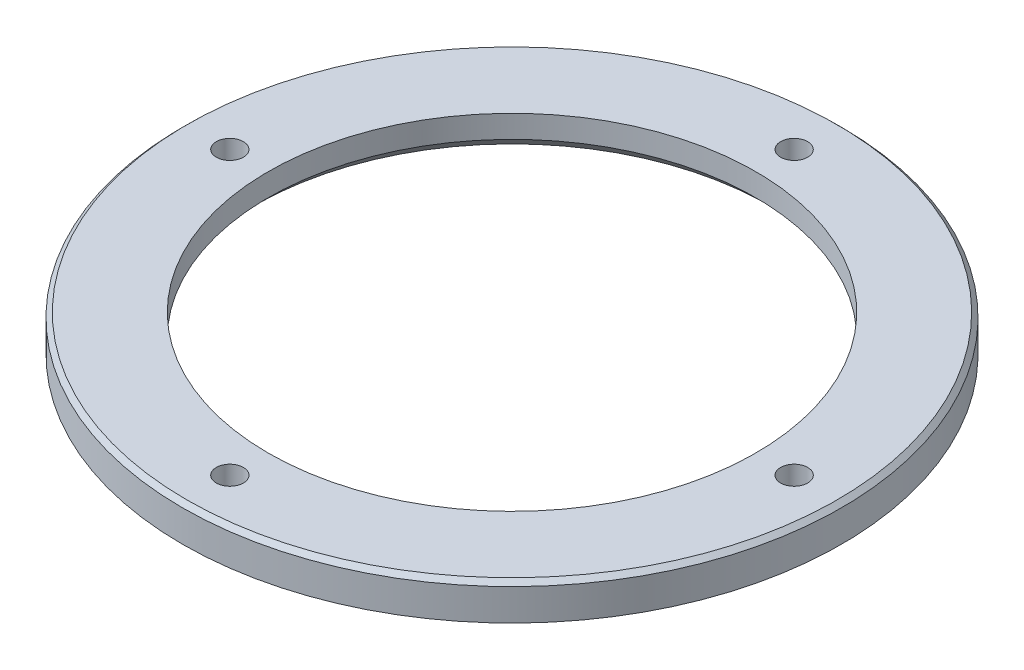
from build123d import *

# Parameters (mm, degrees)
SKETCH_1_R          = 73
SKETCH_1_R_2        = 54
EXTRUDE_1_DEPTH     = 8
SKETCH_2_R          = 3
CUT_EXTRUDE_1_DEPTH = 10
CHAMFER_1_SIZE      = 1
CHAMFER_2_SIZE      = 3


with BuildPart() as part:
    # Эскиз1 → Бобышка-Вытянуть1 (new body)
    with BuildSketch(Plane(origin=(0, 0, 0), x_dir=(1, 0, 0), z_dir=(0, 1, 0))):
        with Locations(Location((0, 0, 0), (0, 0, 270))):
            Circle(SKETCH_1_R)
        with Locations(Location((0, 0, 0), (0, 0, 270))):
            Circle(SKETCH_1_R_2, mode=Mode.SUBTRACT)
    extrude(amount=EXTRUDE_1_DEPTH)

    # Эскиз2 → Вырез-Вытянуть1 (cut)
    with BuildSketch(Plane(origin=(0, 8, 0), x_dir=(-1, 0, 0), z_dir=(0, 1, 0))):
        with Locations(Location((62.5, 0, 0), (0, 0, 90))):
            Circle(SKETCH_2_R)
        with Locations(Location((0, -62.5, 0), (0, 0, 90))):
            Circle(SKETCH_2_R)
        with Locations(Location((0, 62.5, 0), (0, 0, 90))):
            Circle(SKETCH_2_R)
        with Locations(Location((-62.5, 0, 0), (0, 0, 90))):
            Circle(SKETCH_2_R)
    extrude(amount=-CUT_EXTRUDE_1_DEPTH, mode=Mode.SUBTRACT)

    # Фаска1
    chamfer_1_edges = [part.edges().sort_by_distance(p)[0] for p in [
        (0, 8, -73),
    ]]
    chamfer(chamfer_1_edges, length=CHAMFER_1_SIZE)

    # Фаска2
    chamfer_2_edges = [part.edges().sort_by_distance(p)[0] for p in [
        (0, 0, -54),
    ]]
    chamfer(chamfer_2_edges, length=CHAMFER_2_SIZE)


solid = part.part
